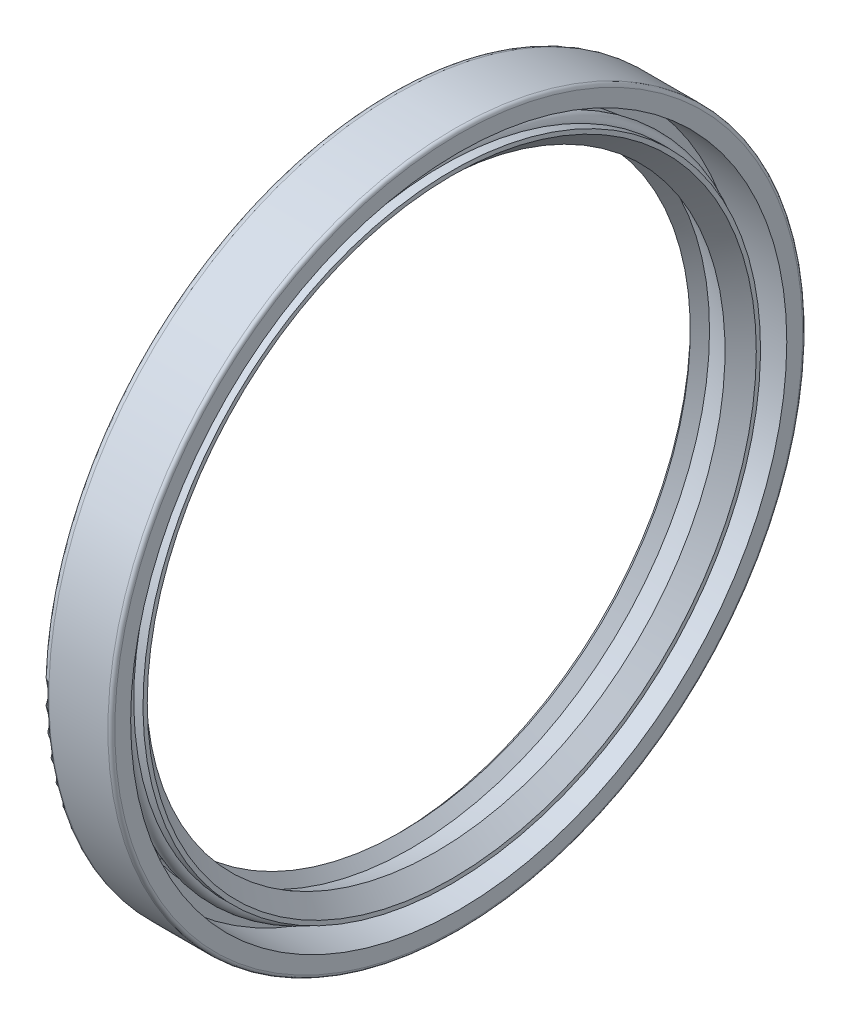
from build123d import *

# Parameters (mm, degrees)
SKETCH2_R = 1.2


with BuildPart() as part:
    # Sketch1 → Revolve1 (revolve)
    with BuildSketch(Plane.XY, mode=Mode.PRIVATE) as revolve1_sk:
        with BuildLine():
            Line((0, 56.666666667), (0.375, 56.666666667))
            Line((0.375, 56.666666667), (0.375, 53.333333333))
            Line((0.375, 53.333333333), (0, 53.333333333))
            Line((0, 53.333333333), (0, 52.5))
            Line((0, 52.5), (2, 51.666666667))
            Line((2, 51.666666667), (1.16668029, 50.828568393))
            Line((1.16668029, 50.828568393), (2, 50))
            Line((2, 50), (3.657163877, 51.666666667))
            Line((3.657163877, 51.666666667), (8, 50))
            Line((8, 50), (10.8, 52.6))
            Line((10.8, 52.6), (10.8, 53.333333333))
            Line((10.8, 53.333333333), (9.2, 53.333333333))
            ThreePointArc((9.2, 53.333333333), (8, 52.133333333), (6.8, 53.333333333))
            Line((6.8, 53.333333333), (4.6, 53.333333333))
            ThreePointArc((4.6, 53.333333333), (4.175735931, 53.509069265), (4, 53.933333333))
            Line((4, 53.933333333), (4, 56.666666667))
            Line((4, 56.666666667), (12, 56.666666667))
            Line((12, 56.666666667), (12, 59.4))
            ThreePointArc((12, 59.4), (11.824264069, 59.824264069), (11.4, 60))
            Line((11.4, 60), (1.2, 60))
            ThreePointArc((1.2, 60), (0.351471863, 59.648528137), (0, 58.8))
            Line((0, 58.8), (0, 56.666666667))
        make_face()
    revolve(revolve1_sk.sketch.rotate(Axis((12, 0, 0), (-1, 0, 0)), 180), axis=Axis((12, 0, 0), (-1, 0, 0)))


with BuildPart() as body_2:
    # Sketch2 → Revolve2 (revolve)
    with BuildSketch(Plane.XY, mode=Mode.PRIVATE) as revolve2_sk:
        with Locations((8, 53.333333333)):
            Circle(SKETCH2_R)
    revolve(revolve2_sk.sketch.rotate(Axis((0, 0, 0), (1, 0, 0)), 90), axis=Axis((0, 0, 0), (1, 0, 0)))


solid = Compound([part.part, body_2.part])
